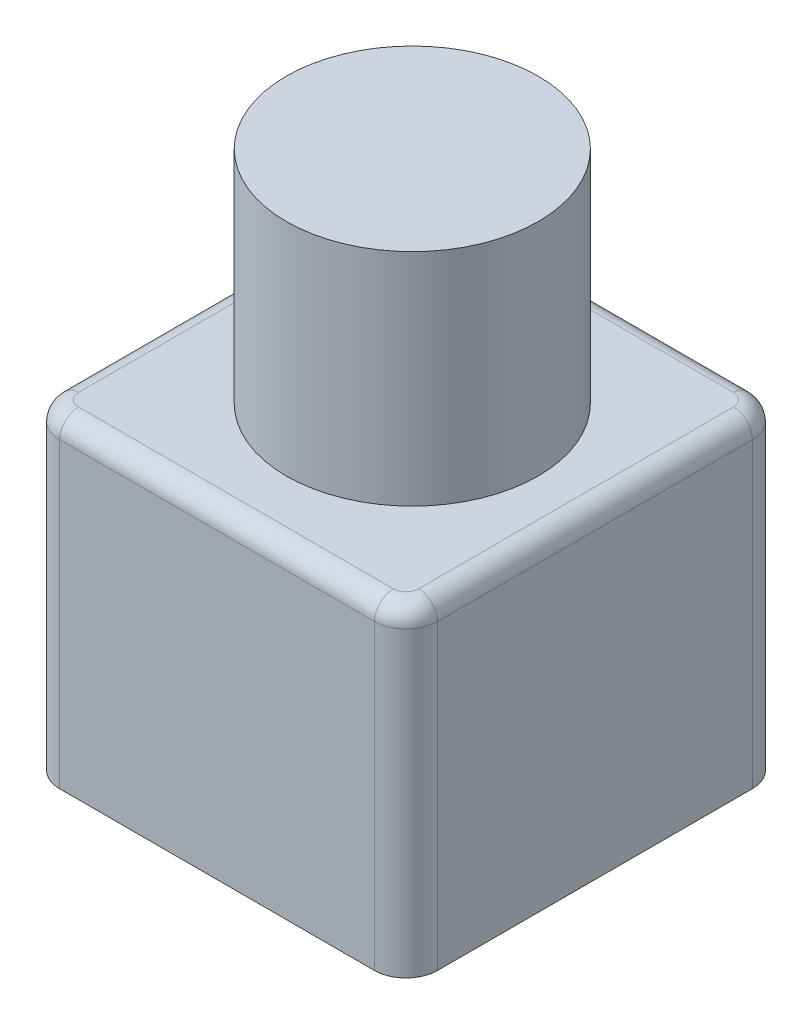
from build123d import *

# Parameters (mm, degrees)
SKETCH_1_W      = 60
SKETCH_1_H      = 60
EXTRUDE_1_DEPTH = 51
SKETCH_2_R      = 20
EXTRUDE_2_DEPTH = 35
SKETCH_4_W      = 30
SKETCH_4_H      = 25
EXTRUDE_3_DEPTH = 2
FILLET_4_R      = 5
FILLET_5_R      = 0.5
FILLET_6_R      = 3


with BuildPart() as part:
    # 草圖1 → 填料-伸長1 (new body)
    with BuildSketch(Plane(origin=(0, 0, 0), x_dir=(1, 0, 0), z_dir=(0, 1, 0))):
        Rectangle(SKETCH_1_W, SKETCH_1_H)
    extrude(amount=EXTRUDE_1_DEPTH)

    # 草圖2 → 填料-伸長2 (add)
    with BuildSketch(Plane(origin=(0, 51, 0), x_dir=(1, 0, 0), z_dir=(0, 1, 0))):
        with Locations(Location((1, 0, 0), (0, 0, 270))):
            Circle(SKETCH_2_R)
    extrude(amount=EXTRUDE_2_DEPTH)

    # 草圖4 → 填料-伸長3 (add)
    with BuildSketch(Plane.ZY.offset(30)):
        with Locations((0, 32.5)):
            Rectangle(SKETCH_4_W, SKETCH_4_H)
    extrude(amount=EXTRUDE_3_DEPTH)

    # 圓角4
    fillet_4_edges = [part.edges().sort_by_distance(p)[0] for p in [
        (30, 25.5, 30),
        (-30, 25.5, 30),
        (-30, 25.5, -30),
        (30, 25.5, -30),
    ]]
    fillet(fillet_4_edges, radius=FILLET_4_R)

    # 圓角5
    fillet_5_edges = [part.edges().sort_by_distance(p)[0] for p in [
        (-32, 32.5, 15),
        (-32, 45, 0),
        (-32, 32.5, -15),
        (-32, 20, 0),
    ]]
    fillet(fillet_5_edges, radius=FILLET_5_R)

    # 圓角6
    fillet_6_edges = [part.edges().sort_by_distance(p)[0] for p in [
        (0, 51, -30),
        (30, 51, 0),
        (-30, 51, 0),
        (0, 51, 30),
        (-28.535533906, 51, 28.535533906),
        (-28.535533906, 51, -28.535533906),
        (28.535533906, 51, 28.535533906),
        (28.535533906, 51, -28.535533906),
    ]]
    fillet(fillet_6_edges, radius=FILLET_6_R)


solid = part.part
